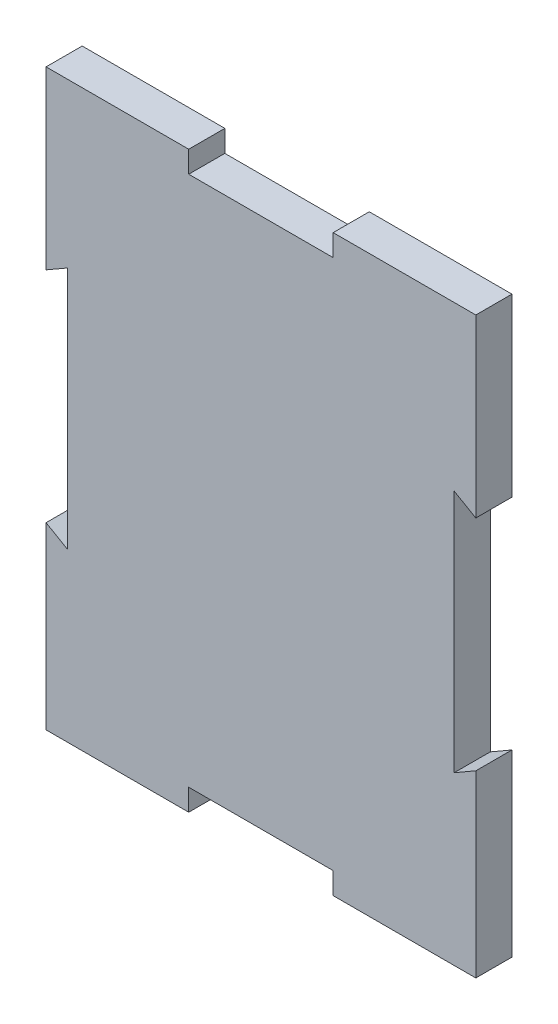
from build123d import *

# Parameters (mm, degrees)
BOSS_EXTRUDE1_DEPTH = 5


with BuildPart() as part:
    # Sketch4 → Boss-Extrude1 (new body)
    with BuildSketch(Plane(origin=(0, 0, 0), x_dir=(0, 1, 0), z_dir=(0, 0, 1))):
        Polygon((-39.75, -29.75), (-14.905444566, -29.75), (-16.637495374, -26.75), (0.24999995, -26.75), (17.137495374, -26.75), (15.405444566, -29.75), (39.75, -29.75), (39.75, -10), (36.75, -10), (36.75, 10), (39.75, 10), (39.75, 29.75), (15.405444566, 29.75), (17.137495374, 26.75), (0.250000065, 26.75), (-16.637495374, 26.75), (-14.905444566, 29.75), (-39.75, 29.75), (-39.75, 10), (-36.75, 10), (-36.75, -10), (-39.75, -10), align=None)
    extrude(amount=BOSS_EXTRUDE1_DEPTH)


solid = part.part
